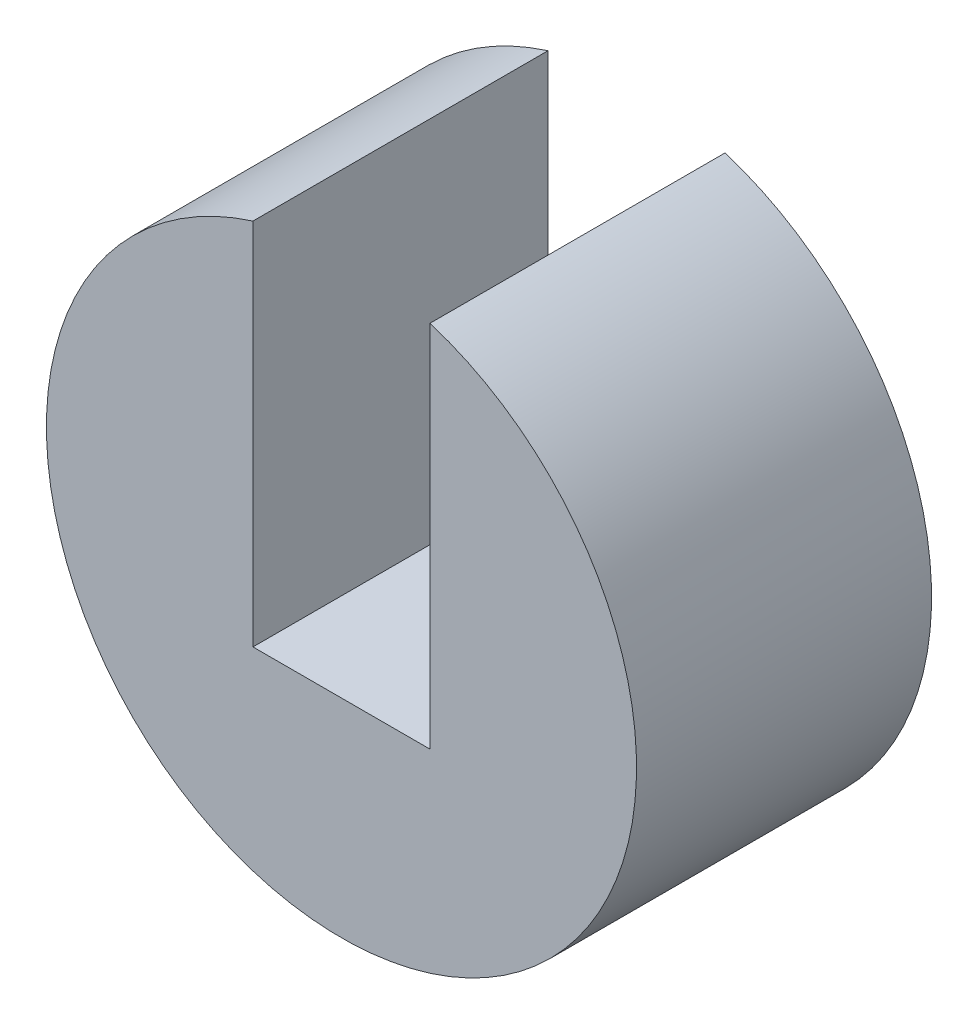
from build123d import *

# Parameters (mm, degrees)
BOSS_EXTRUDE1_DEPTH = 5


with BuildPart() as part:
    # Sketch1 → Boss-Extrude1 (new body)
    with BuildSketch(Plane.XY):
        with BuildLine():
            ThreePointArc((5, -1.644696007), (4.031128874, 1.313343884), (1.5, 3.125))
            Line((1.5, 3.125), (1.5, -3.125))
            Line((1.5, -3.125), (-1.5, -3.125))
            Line((-1.5, -3.125), (-1.5, 3.125))
            ThreePointArc((-1.5, 3.125), (-2.958039892, -5.675824881), (5, -1.644696007))
        make_face()
    extrude(amount=BOSS_EXTRUDE1_DEPTH)


solid = part.part
